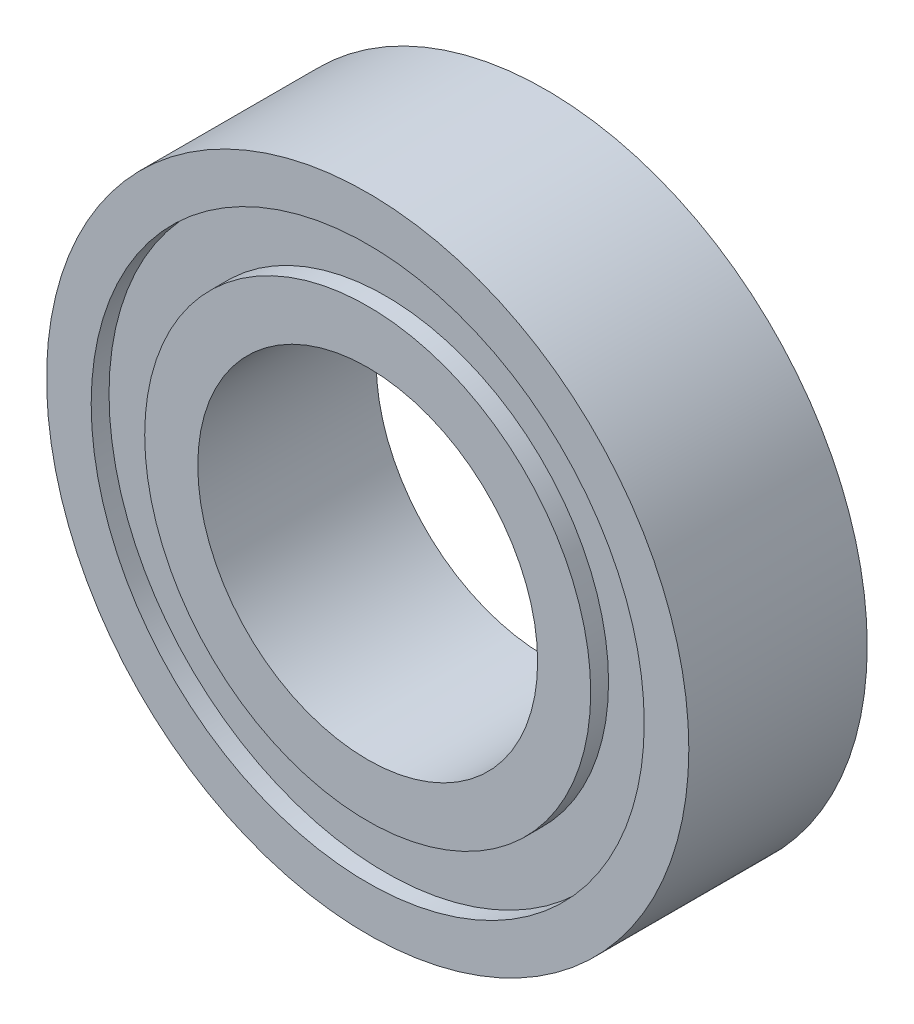
from build123d import *

# Parameters (mm, degrees)
ESBO_O1_R                = 9
ESBO_O1_R_2              = 4.7625
RESSALTO_EXTRUS_O1_DEPTH = 5
ESBO_O2_R                = 7.75
ESBO_O2_R_2              = 6.25
CORTE_EXTRUS_O1_DEPTH    = 0.5


with BuildPart() as part:
    # Esboço1 → Ressalto-extrusão1 (new body)
    with BuildSketch(Plane.XY):
        Circle(ESBO_O1_R)
        Circle(ESBO_O1_R_2, mode=Mode.SUBTRACT)
    extrude(amount=RESSALTO_EXTRUS_O1_DEPTH)

    # Esboço2 → Corte-extrusão1 (cut)
    with BuildSketch(Plane(origin=(0, 0, 0), x_dir=(-1, 0, 0), z_dir=(0, 0, -1))):
        Circle(ESBO_O2_R)
        Circle(ESBO_O2_R_2, mode=Mode.SUBTRACT)
    corte_extrus_o1 = extrude(amount=-CORTE_EXTRUS_O1_DEPTH, mode=Mode.SUBTRACT)

    # Espelhar2: Corte-extrusão1 across plane
    add(corte_extrus_o1.mirror(Plane.XY.offset(2.5)), mode=Mode.SUBTRACT)


solid = part.part
